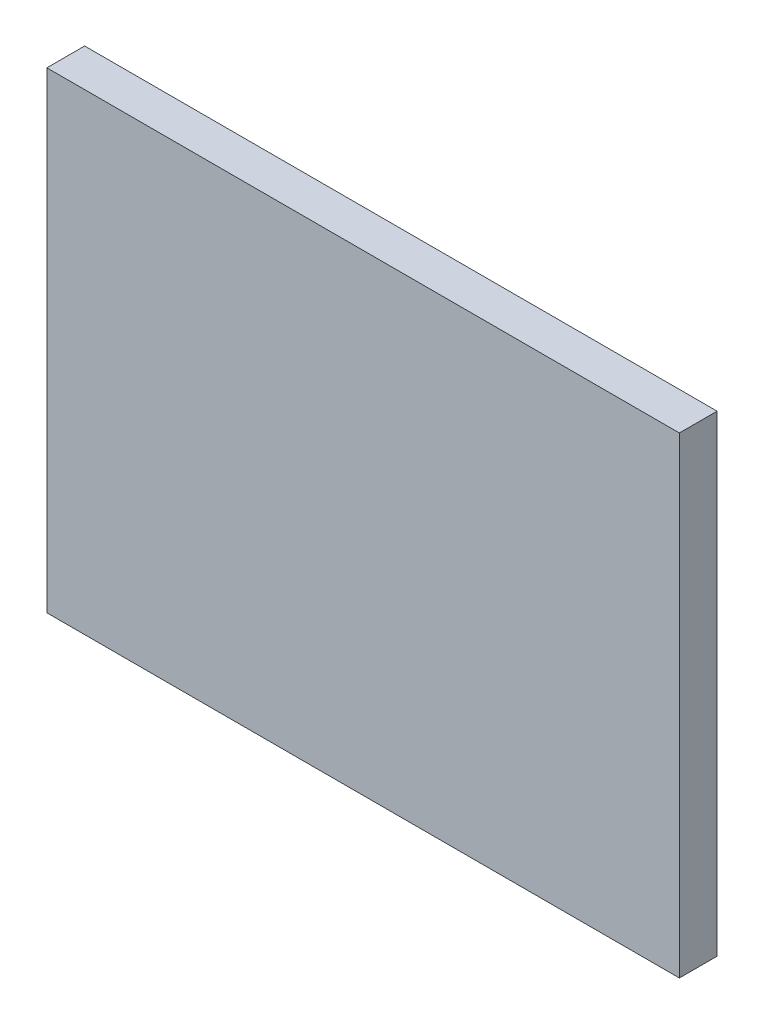
from build123d import *

# Parameters (mm, degrees)
SKETCH2_W      = 212.725
SKETCH2_H      = 158.75
EXTRUDE1_DEPTH = 12.7


with BuildPart() as part:
    # Sketch2 → Extrude1 (new body)
    with BuildSketch(Plane.XY):
        with Locations((-4872.0375, 1298.575)):
            Rectangle(SKETCH2_W, SKETCH2_H)
    extrude(amount=-EXTRUDE1_DEPTH)


solid = part.part
